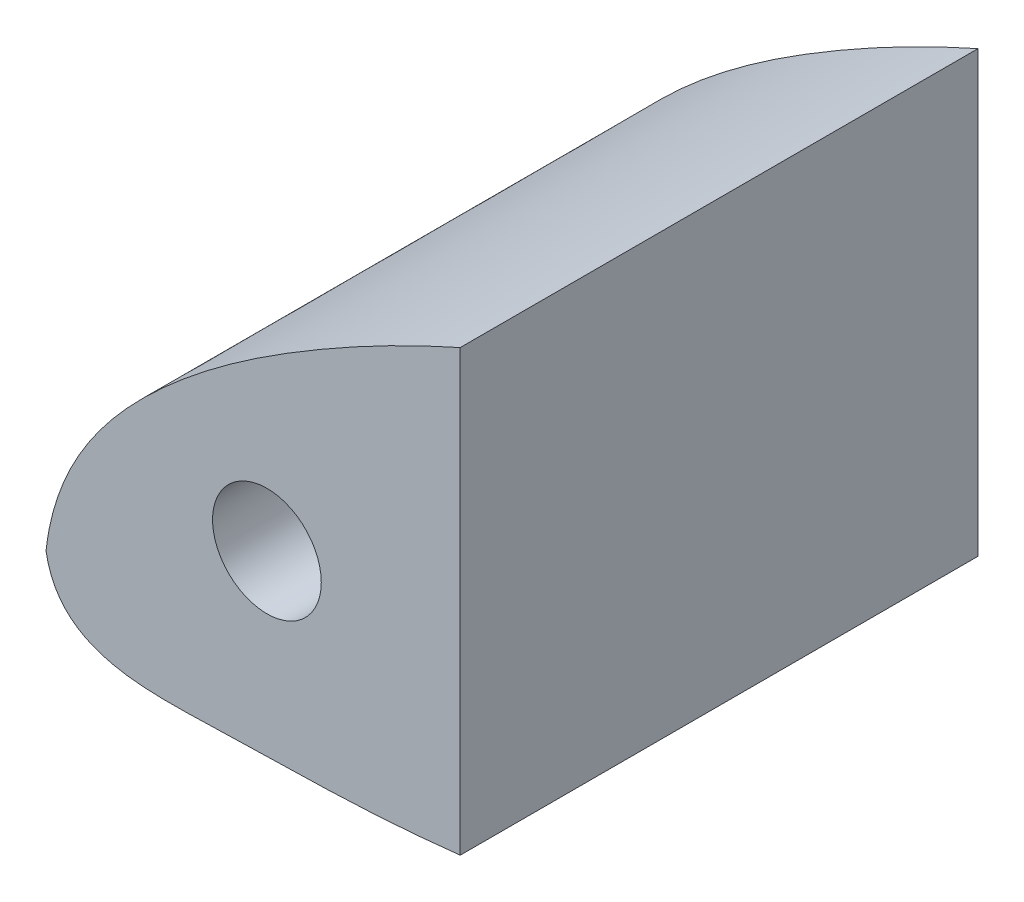
from build123d import *

# Parameters (mm, degrees)
BOSS_EXTRUDE1_DEPTH = 47.625
SKETCH2_R           = 5
SKETCH2_R_2         = 3.175
CUT_EXTRUDE1_DEPTH  = 320.299711675
SKETCH3_W           = 293.188888759
SKETCH3_H           = 137.971241769
CUT_EXTRUDE2_DEPTH  = 320.299711675


with BuildPart() as part:
    # Sketch1 → Boss-Extrude1 (new body)
    with BuildSketch(Plane.XY):
        with BuildLine():
            add(Edge.make_bspline(
                [(0.000560351, 0.000130087), (0.810633127, 7.359196055), (8.649092025, 17.856605174), (26.286719818, 29.975176328), (52.111128271, 42.069215275), (89.597618475, 49.290763054), (131.400792109, 47.884831915), (173.256699242, 40.041104278), (217.961060472, 29.612974894), (256.952064401, 19.528920948), (290.35983767, 8.71099439), (301.273197721, 4.382828139), (314.816918223, -0.516206742), (309.846313895, 0.000130087)],
                knots=[0, 0, 0, 0, 0.060863618, 0.113688265, 0.188608742, 0.312908923, 0.448482434, 0.557612135, 0.691544113, 0.852438279, 0.92975597, 0.976058229, 1, 1, 1, 1], degree=3))
            add(Edge.make_bspline(
                [(309.846313895, 0.000130087), (303.956832565, 1.47095521), (293.989507544, 2.093987313), (276.26402299, 4.514356704), (260.846344817, 5.427413394), (235.858814759, 7.870306192), (205.101424636, 8.838080282), (157.718638092, 9.030650149), (110.497331172, 6.181495223), (66.506197185, -0.586669107), (36.454672816, -6.098499901), (15.316603331, -6.189065841), (1.230714189, -6.924076091), (0.000560351, 0.000130087)],
                knots=[0, 0, 0, 0, 0.057787081, 0.095274891, 0.171021118, 0.205339302, 0.335319146, 0.464904334, 0.658702312, 0.785511947, 0.893517288, 0.94309214, 1, 1, 1, 1], degree=3))
        make_face()
    extrude(amount=BOSS_EXTRUDE1_DEPTH)

    # Sketch2 → Cut-Extrude1 (cut, through all)
    with BuildSketch(Plane.XY.offset(47.625)):
        with Locations((20.32, 10.16)):
            Circle(SKETCH2_R)
        with Locations((227.296313895, 19.050130087)):
            Circle(SKETCH2_R_2)
    extrude(amount=-CUT_EXTRUDE1_DEPTH, mode=Mode.SUBTRACT)

    # Sketch3 → Cut-Extrude2 (cut, through all)
    with BuildSketch(Plane.XY.offset(47.625)):
        with Locations((184.69444438, 2.732377951)):
            Rectangle(SKETCH3_W, SKETCH3_H)
    extrude(amount=-CUT_EXTRUDE2_DEPTH, mode=Mode.SUBTRACT)


solid = part.part
